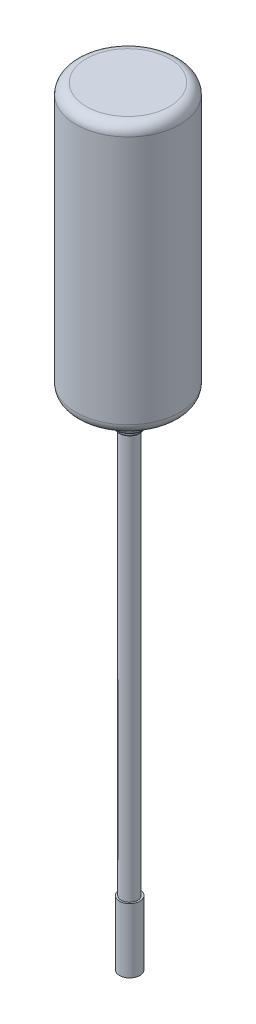
from build123d import *

# Parameters (mm, degrees)
SKETCH1_R           = 25
BOSS_EXTRUDE1_DEPTH = 130
SKETCH2_R           = 4
BOSS_EXTRUDE2_DEPTH = 240
FILLET1_R           = 5
SKETCH3_R           = 1.453879909
BOSS_EXTRUDE3_DEPTH = 11
SKETCH5_R           = 4.874031528
BOSS_EXTRUDE4_DEPTH = 31
SKETCH4_R           = 8
BOSS_EXTRUDE5_DEPTH = 6
SKETCH6_R           = 6.008121905
BOSS_EXTRUDE6_DEPTH = 3
SKETCH7_R           = 7
BOSS_EXTRUDE7_DEPTH = 3
SKETCH8_R           = 5.120351742
BOSS_EXTRUDE8_DEPTH = 2
FILLET2_R           = 1
FILLET3_R           = 0.7
FILLET4_R           = 0.5


with BuildPart() as part:
    # Sketch1 → Boss-Extrude1 (new body)
    with BuildSketch(Plane(origin=(0, 0, 0), x_dir=(1, 0, 0), z_dir=(0, 1, 0))):
        with Locations(Location((-177.963076726, -16.906492289, 0), (0, 0, 270))):
            Circle(SKETCH1_R)
    extrude(amount=-BOSS_EXTRUDE1_DEPTH)

    # Sketch2 → Boss-Extrude2 (add)
    with BuildSketch(Plane.XZ.offset(130)):
        with Locations(Location((-177.673880688, 16.459807513, 0), (0, 0, 270))):
            Circle(SKETCH2_R)
    extrude(amount=BOSS_EXTRUDE2_DEPTH)

    # Fillet1
    fillet1_edges = [part.edges().sort_by_distance(p)[0] for p in [
        (-177.963076726, 0, -8.093507711),
        (-177.963076726, -130, -8.093507711),
    ]]
    fillet(fillet1_edges, radius=FILLET1_R)

    # Sketch3 → Boss-Extrude3 (add)
    with BuildSketch(Plane.XZ.offset(370)):
        with Locations((-177.696828735, 16.529309624)):
            Circle(SKETCH3_R)
    extrude(amount=-BOSS_EXTRUDE3_DEPTH)

    # Sketch5 → Boss-Extrude4 (add)
    with BuildSketch(Plane.XZ.offset(370)):
        with Locations(Location((-177.682359617, 16.368630896, 0), (0, 0, 270))):
            Circle(SKETCH5_R)
    extrude(amount=-BOSS_EXTRUDE4_DEPTH)

    # Sketch4 → Boss-Extrude5 (add)
    with BuildSketch(Plane.XZ.offset(130)):
        with Locations(Location((-177.682359617, 16.368630896, 0), (0, 0, 90))):
            Circle(SKETCH4_R)
    extrude(amount=BOSS_EXTRUDE5_DEPTH)

    # Sketch6 → Boss-Extrude6 (add)
    with BuildSketch(Plane.XZ.offset(136)):
        with Locations(Location((-177.673880688, 16.459807513, 0), (0, 0, 270))):
            Circle(SKETCH6_R)
    extrude(amount=BOSS_EXTRUDE6_DEPTH)

    # Sketch7 → Boss-Extrude7 (add)
    with BuildSketch(Plane.XZ.offset(139)):
        with Locations(Location((-177.682359617, 16.368630896, 0), (0, 0, 270))):
            Circle(SKETCH7_R)
    extrude(amount=BOSS_EXTRUDE7_DEPTH)

    # Sketch8 → Boss-Extrude8 (add)
    with BuildSketch(Plane.XZ.offset(142)):
        with Locations(Location((-177.673880688, 16.459807513, 0), (0, 0, 270))):
            Circle(SKETCH8_R)
    extrude(amount=BOSS_EXTRUDE8_DEPTH)

    # Fillet2
    fillet2_edges = [part.edges().sort_by_distance(p)[0] for p in [
        (-177.682359617, -136, 8.368630896),
        (-177.682359617, -142, 23.368630896),
    ]]
    fillet(fillet2_edges, radius=FILLET2_R)

    # Fillet3
    fillet3_edges = [part.edges().sort_by_distance(p)[0] for p in [
        (-177.673880688, -139, 22.467929418),
    ]]
    fillet(fillet3_edges, radius=FILLET3_R)

    # Fillet4
    fillet4_edges = [part.edges().sort_by_distance(p)[0] for p in [
        (-177.673880688, -144, 21.580159255),
    ]]
    fillet(fillet4_edges, radius=FILLET4_R)


solid = part.part
